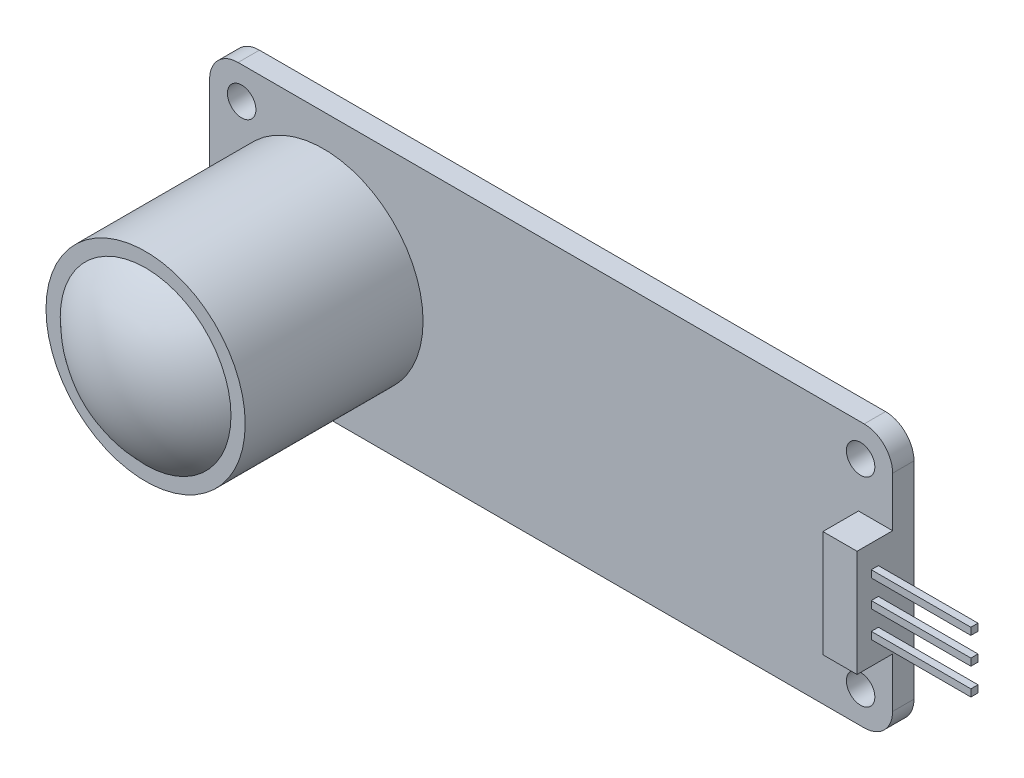
from build123d import *

# Parameters (mm, degrees)
SKETCH1_W           = 48
SKETCH1_H           = 18.5
SKETCH1_R           = 1
BOSS_EXTRUDE1_DEPTH = 1.5
FILLET1_R           = 2
SKETCH2_R           = 7
BOSS_EXTRUDE2_DEPTH = 12.5
SKETCH5_W           = 2.4
SKETCH5_H           = 7.5
BOSS_EXTRUDE3_DEPTH = 2.5
SKETCH6_W           = 0.5
SKETCH6_H           = 0.5
BOSS_EXTRUDE4_DEPTH = 7


with BuildPart() as part:
    # Sketch1 → Boss-Extrude1 (new body)
    with BuildSketch(Plane.XY):
        Rectangle(SKETCH1_W, SKETCH1_H)
        with Locations((-21.75, 7)):
            Circle(SKETCH1_R, mode=Mode.SUBTRACT)
        with Locations((21.75, 7)):
            Circle(SKETCH1_R, mode=Mode.SUBTRACT)
        with Locations((21.75, -7)):
            Circle(SKETCH1_R, mode=Mode.SUBTRACT)
        with Locations((-21.75, -7)):
            Circle(SKETCH1_R, mode=Mode.SUBTRACT)
    extrude(amount=BOSS_EXTRUDE1_DEPTH)

    # Fillet1
    fillet1_edges = [part.edges().sort_by_distance(p)[0] for p in [
        (24, -9.25, 0.75),
        (-24, -9.25, 0.75),
        (-24, 9.25, 0.75),
        (24, 9.25, 0.75),
    ]]
    fillet(fillet1_edges, radius=FILLET1_R)

    # Sketch2 → Boss-Extrude2 (add)
    with BuildSketch(Plane.XY.offset(1.5)):
        with Locations(Location((-16, 0, 0), (0, 0, 180))):
            Circle(SKETCH2_R)
    extrude(amount=BOSS_EXTRUDE2_DEPTH)

    # Sketch3 → Revolve3 (revolve)
    with BuildSketch(Plane(origin=(0, 0, 0), x_dir=(-1, 0, 0), z_dir=(0, -1, 0))):
        with BuildLine():
            Line((16, -14), (16, -16.5))
            ThreePointArc((16, -16.5), (19.25, -15.85), (22, -14))
            Line((22, -14), (16, -14))
        make_face()
    revolve(axis=Axis((-16, 0, 1014), (0, 0, -1)))

    # Sketch5 → Boss-Extrude3 (add)
    with BuildSketch(Plane.XY.offset(1.5)):
        with Locations((22.8, 0)):
            Rectangle(SKETCH5_W, SKETCH5_H)
    extrude(amount=BOSS_EXTRUDE3_DEPTH)

    # Sketch6 → Boss-Extrude4 (add)
    with BuildSketch(Plane(origin=(24, 0, 0), x_dir=(0, 0, -1), z_dir=(1, 0, 0))):
        with Locations((-2.75, 1.875)):
            Rectangle(SKETCH6_W, SKETCH6_H)
        with Locations((-2.75, 0)):
            Rectangle(SKETCH6_W, SKETCH6_H)
        with Locations((-2.75, -1.875)):
            Rectangle(SKETCH6_W, SKETCH6_H)
    extrude(amount=BOSS_EXTRUDE4_DEPTH)


solid = part.part
